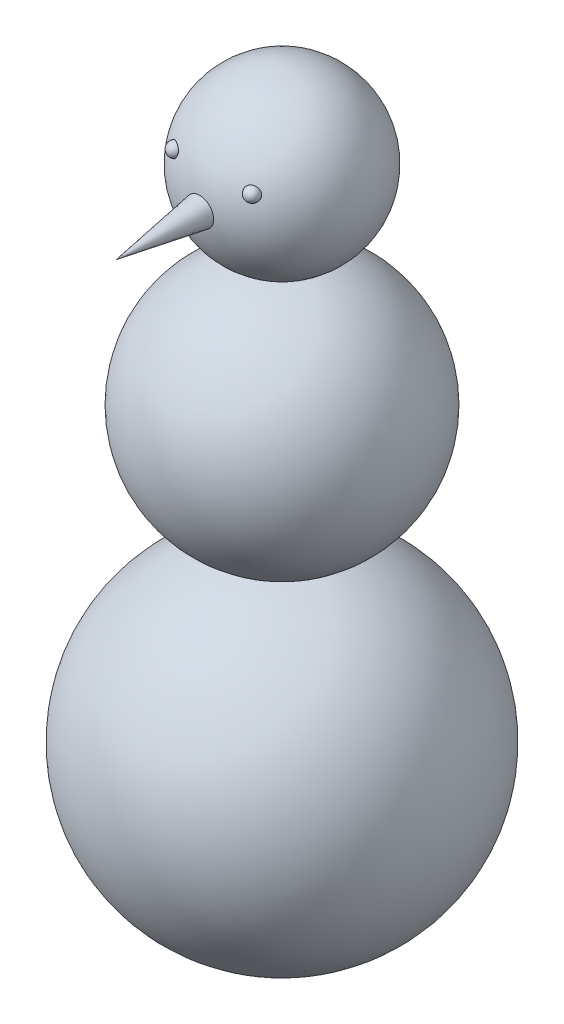
from build123d import *


with BuildPart() as part:
    # Sketch1 → Bottom (revolve)
    with BuildSketch(Plane.XY):
        with BuildLine():
            Line((0, -304.8), (0, 304.8))
            ThreePointArc((0, 304.8), (304.8, 0), (0, -304.8))
        make_face()
    revolve(axis=Axis((0, -304.8, 0), (0, 1, 0)))


with BuildPart() as body_2:
    # Sketch2 → Middle (revolve)
    with BuildSketch(Plane.XY):
        with BuildLine():
            Line((0, 304.8), (0, 762))
            ThreePointArc((0, 762), (228.6, 533.4), (0, 304.8))
        make_face()
    revolve(axis=Axis((0, 304.8, 0), (0, 1, 0)))


with BuildPart() as body_3:
    # Sketch3 → Top (revolve)
    with BuildSketch(Plane.XY):
        with BuildLine():
            Line((0, 762), (0, 1066.8))
            ThreePointArc((0, 1066.8), (152.4, 914.4), (0, 762))
        make_face()
    revolve(axis=Axis((0, -304.8, 0), (0, 1, 0)))

    # Sketch5 → Revolve4 (revolve)
    with BuildSketch(Plane(origin=(0, 914.4, 0), x_dir=(1, 0, 0), z_dir=(0, 1, 0)), mode=Mode.PRIVATE) as revolve4_sk:
        with BuildLine():
            Line((0, -302.668426491), (25.4, -150.268426491))
            ThreePointArc((25.4, -150.268426491), (12.744642067, -151.866171673), (0, -152.4))
            Line((0, -152.4), (0, -302.668426491))
        make_face()
    revolve(revolve4_sk.sketch.rotate(Axis((0, 914.4, 150.268426491), (0, 0, 1)), 180), axis=Axis((0, 914.4, 150.268426491), (0, 0, 1)))

    # Sketch7 → Revolve5 (revolve)
    with BuildSketch(Plane(origin=(0, 965.2, 0), x_dir=(1, 0, 0), z_dir=(0, 1, 0))):
        with BuildLine():
            Line((70.632787724, -125.124455237), (76.2, -136.539189026))
            ThreePointArc((76.2, -136.539189026), (82.840114379, -128.627479065), (81.405616632, -118.398672209))
            ThreePointArc((81.405616632, -118.398672209), (76.093548604, -121.880645965), (70.632787724, -125.124455237))
        make_face()
    revolve5 = revolve(axis=Axis((76.2, 965.2, 136.539189026), (-0.4383631713005526, 0, -0.8987979361610274)))

    # Mirror1: Revolve5 across plane
    add(revolve5.mirror(Plane(origin=(0, 0, 0), x_dir=(0, 0, 1), z_dir=(1, 0, 0))))


solid = Compound([part.part, body_2.part, body_3.part])
